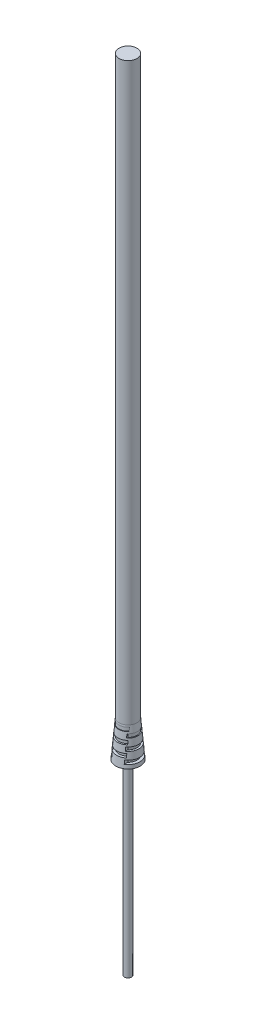
from build123d import *

# Parameters (mm, degrees)
SKETCH2_R           = 1.25
BOSS_EXTRUDE1_DEPTH = 80
SKETCH3_R           = 1.25
BOSS_EXTRUDE2_DEPTH = 5
BOSS_EXTRUDE2_DRAFT = -5
CUT_EXTRUDE3_START  = -0.5
CUT_EXTRUDE3_DEPTH  = 0.5
LPATTERN1_COUNT     = 3
LPATTERN1_PITCH     = 1.5
CUT_EXTRUDE4_START  = -1.25
CUT_EXTRUDE4_DEPTH  = 0.5
LPATTERN2_COUNT     = 3
LPATTERN2_PITCH     = 1.5
SKETCH7_R           = 0.5
BOSS_EXTRUDE3_DEPTH = 26


with BuildPart() as part:
    # Sketch2 → Boss-Extrude1 (new body)
    with BuildSketch(Plane(origin=(0, 0, 0), x_dir=(1, 0, 0), z_dir=(0, 1, 0))):
        with Locations(Location((0, 0, 0), (0, 0, 270))):
            Circle(SKETCH2_R)
    extrude(amount=BOSS_EXTRUDE1_DEPTH)


with BuildPart() as boss_extrude2_tool:
    # Sketch3 → Boss-Extrude2 (with draft: the straight prism first)
    with BuildSketch(Plane.XZ):
        with Locations(Location((0, 0, 0), (0, 0, 270))):
            Circle(SKETCH3_R)
    extrude(amount=BOSS_EXTRUDE2_DEPTH)
    # Boss-Extrude2: the draft: its side faces are tilted about the plane it starts from
    boss_extrude2_sides = [boss_extrude2_tool.faces().sort_by_distance(p)[0] for p in [
        (0, -2.5, 1.25),
    ]]
    draft(boss_extrude2_sides, Plane.XZ, BOSS_EXTRUDE2_DRAFT)


with BuildPart() as part_1:
    add(part.part)

    # Boss-Extrude2: add boss_extrude2_tool
    add(boss_extrude2_tool.part)

    # Sketch4 → Cut-Extrude3 (cut)
    with BuildSketch(Plane.XZ.offset(5).offset(CUT_EXTRUDE3_START)):
        with BuildLine():
            Line((-0.87, 0.897552227), (-0.87, 1.445878608))
            ThreePointArc((-0.87, 1.445878608), (-1.687443318, 0), (-0.87, -1.445878608))
            Line((-0.87, -1.445878608), (-0.87, -0.897552227))
            ThreePointArc((-0.87, -0.897552227), (-1.25, 0), (-0.87, 0.897552227))
        make_face()
        with BuildLine():
            ThreePointArc((1.687443318, 0), (1.468935097, 0.830478556), (0.87, 1.445878608))
            Line((0.87, 1.445878608), (0.87, 0.897552227))
            ThreePointArc((0.87, 0.897552227), (1.151086443, 0.487339717), (1.25, 0))
            ThreePointArc((1.25, 0), (1.151086443, -0.487339717), (0.87, -0.897552227))
            Line((0.87, -0.897552227), (0.87, -1.445878608))
            ThreePointArc((0.87, -1.445878608), (1.468935097, -0.830478556), (1.687443318, 0))
        make_face()
    cut_extrude3 = extrude(amount=-CUT_EXTRUDE3_DEPTH, mode=Mode.SUBTRACT)

    # LPattern1: Cut-Extrude3 ×3
    with Locations(*[(0, i * LPATTERN1_PITCH, 0) for i in range(1, LPATTERN1_COUNT)]):
        add(cut_extrude3, mode=Mode.SUBTRACT)

    # Sketch6 → Cut-Extrude4 (cut)
    with BuildSketch(Plane.XZ.offset(5).offset(CUT_EXTRUDE4_START)):
        with BuildLine():
            Line((-1, 1.359214829), (-1, 0.75))
            ThreePointArc((-1, 0.75), (0, 1.25), (1, 0.75))
            Line((1, 0.75), (1, 1.359214829))
            ThreePointArc((1, 1.359214829), (0, 1.687443318), (-1, 1.359214829))
        make_face()
        with BuildLine():
            ThreePointArc((1, -0.75), (0, -1.25), (-1, -0.75))
            Line((-1, -0.75), (-1, -1.359214829))
            ThreePointArc((-1, -1.359214829), (0, -1.687443318), (1, -1.359214829))
            Line((1, -1.359214829), (1, -0.75))
        make_face()
    cut_extrude4 = extrude(amount=-CUT_EXTRUDE4_DEPTH, mode=Mode.SUBTRACT)

    # LPattern2: Cut-Extrude4 ×3
    with Locations(*[(0, i * LPATTERN2_PITCH, 0) for i in range(1, LPATTERN2_COUNT)]):
        add(cut_extrude4, mode=Mode.SUBTRACT)

    # Sketch7 → Boss-Extrude3 (add)
    with BuildSketch(Plane.XZ.offset(5)):
        with Locations(Location((0, 0, 0), (0, 0, 270))):
            Circle(SKETCH7_R)
    extrude(amount=BOSS_EXTRUDE3_DEPTH)


solid = part_1.part
